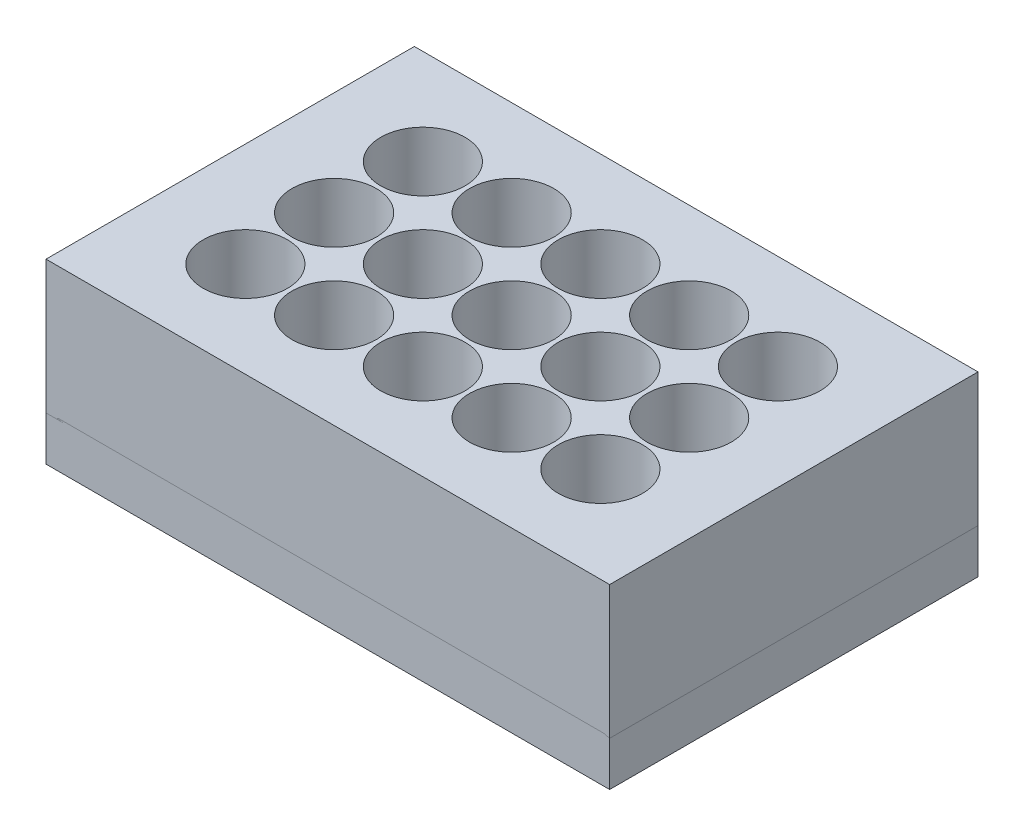
from build123d import *

# Parameters (mm, degrees)
SKETCH1_W            = 127
SKETCH1_H            = 83
BOSS_EXTRUDE1_DEPTH  = 10.31875
CUT_EXTRUDE2_DEPTH   = 2
CUT_EXTRUDE3_DEPTH   = 4
SKETCH2_9_R          = 2.5
CUT_EXTRUDE8_DEPTH   = 77.557015365
LPATTERN2_COUNT      = 4
LPATTERN2_PITCH      = 20
LPATTERN2_COUNT_DIR2 = 6
LPATTERN2_PITCH_DIR2 = 20
LPATTERN3_COUNT      = 3
LPATTERN3_PITCH      = 20
LPATTERN3_COUNT_DIR2 = 5
LPATTERN3_PITCH_DIR2 = 20
SKETCH4_W            = 127
SKETCH4_H            = 83
BOSS_EXTRUDE3_DEPTH  = 30
SKETCH10_R           = 9.5
CUT_EXTRUDE11_DEPTH  = 80.871772235
CUT_EXTRUDE9_START   = 3.7
SKETCH8_R            = 2.5
CUT_EXTRUDE9_DEPTH   = 3.7
SKETCH8_11_R         = 2.2352
CUT_EXTRUDE10_DEPTH  = 82.575118756
CUT_EXTRUDE12_START  = -82.575118756
SKETCH8_12_R         = 4.0132
SKETCH8_12_R_2       = 2.2352
CUT_EXTRUDE12_DEPTH  = 83.641918756
LPATTERN4_COUNT      = 6
LPATTERN4_PITCH      = 20
LPATTERN4_COUNT_DIR2 = 4
LPATTERN4_PITCH_DIR2 = 20
SKETCH8_13_R         = 6.4008
SKETCH8_13_R_2       = 4.6228
CUT_EXTRUDE16_DEPTH  = 1.3208
LPATTERN5_COUNT      = 5
LPATTERN5_PITCH      = 20
LPATTERN5_COUNT_DIR2 = 3
LPATTERN5_PITCH_DIR2 = 20


with BuildPart() as part:
    # Sketch1 → Boss-Extrude1 (new body)
    with BuildSketch(Plane(origin=(0, 0, 0), x_dir=(1, 0, 0), z_dir=(0, 1, 0))):
        Rectangle(SKETCH1_W, SKETCH1_H)
    extrude(amount=BOSS_EXTRUDE1_DEPTH)

    # Sketch2 → Cut-Extrude2 (cut)
    with BuildSketch(Plane(origin=(0, 10.31875, 0), x_dir=(1, 0, 0), z_dir=(0, 1, 0))):
        with BuildLine():
            ThreePointArc((-45.247281281, -24.625), (-45.689223019, -25.691941738), (-44.622281281, -25.25))
            Line((-44.622281281, -25.25), (-35.372281281, -25.25))
            ThreePointArc((-35.372281281, -25.25), (-34.305339543, -25.691941738), (-34.747281281, -24.625))
            Line((-34.747281281, -24.625), (-34.747281281, -15.375))
            ThreePointArc((-34.747281281, -15.375), (-34.305339543, -14.308058262), (-35.372281281, -14.75))
            Line((-35.372281281, -14.75), (-44.622281281, -14.75))
            ThreePointArc((-44.622281281, -14.75), (-45.689223019, -14.308058262), (-45.247281281, -15.375))
            Line((-45.247281281, -15.375), (-45.247281281, -24.625))
        make_face()
    cut_extrude2 = extrude(amount=-CUT_EXTRUDE2_DEPTH, mode=Mode.SUBTRACT)

    # Sketch2<6> → Cut-Extrude3 (cut)
    with BuildSketch(Plane(origin=(0, 10.31875, 0), x_dir=(1, 0, 0), z_dir=(0, 1, 0))):
        with BuildLine():
            ThreePointArc((-52.58, -30), (-51.847766953, -31.767766953), (-50.08, -32.5))
            ThreePointArc((-50.08, -32.5), (-48.312233047, -31.767766953), (-47.58, -30))
            ThreePointArc((-47.58, -30), (-50.08, -27.5), (-52.58, -30))
        make_face()
    cut_extrude3 = extrude(amount=-CUT_EXTRUDE3_DEPTH, mode=Mode.SUBTRACT)

    # Sketch2<9> → Cut-Extrude8 (cut, through all)
    with BuildSketch(Plane(origin=(0, 10.31875, 0), x_dir=(1, 0, 0), z_dir=(0, 1, 0))):
        with Locations((-40.08, -20)):
            Circle(SKETCH2_9_R)
    cut_extrude8 = extrude(amount=-CUT_EXTRUDE8_DEPTH, mode=Mode.SUBTRACT)

    # LPattern2: Cut-Extrude3 4 × 6
    with Locations(*[(j * LPATTERN2_PITCH_DIR2, 0, -i * LPATTERN2_PITCH) for i in range(LPATTERN2_COUNT) for j in range(LPATTERN2_COUNT_DIR2) if (i, j) != (0, 0)]):
        add(cut_extrude3, mode=Mode.SUBTRACT)

    # LPattern3: Cut-Extrude2, Cut-Extrude8 3 × 5
    with Locations(*[(j * LPATTERN3_PITCH_DIR2, 0, -i * LPATTERN3_PITCH) for i in range(LPATTERN3_COUNT) for j in range(LPATTERN3_COUNT_DIR2) if (i, j) != (0, 0)]):
        add(cut_extrude2, mode=Mode.SUBTRACT)
        add(cut_extrude8, mode=Mode.SUBTRACT)


with BuildPart() as body_2:
    # Sketch4 → Boss-Extrude3 (new body)
    with BuildSketch(Plane(origin=(0, 10, 0), x_dir=(1, 0, 0), z_dir=(0, 1, 0))):
        Rectangle(SKETCH4_W, SKETCH4_H)
    extrude(amount=BOSS_EXTRUDE3_DEPTH)

    # Sketch10 → Cut-Extrude11 (cut, through all)
    with BuildSketch(Plane(origin=(0, 15, 0), x_dir=(1, 0, 0), z_dir=(0, 1, 0))):
        with Locations((-40.08, -20)):
            Circle(SKETCH10_R)
    cut_extrude11 = extrude(amount=CUT_EXTRUDE11_DEPTH, mode=Mode.SUBTRACT)

    # Sketch8 → Cut-Extrude9 (cut)
    with BuildSketch(Plane(origin=(0, 10, 0), x_dir=(1, 0, 0), z_dir=(0, 1, 0)).offset(CUT_EXTRUDE9_START)):
        with Locations((-50.08, -30)):
            Circle(SKETCH8_R)
    cut_extrude9 = extrude(amount=-CUT_EXTRUDE9_DEPTH, mode=Mode.SUBTRACT)

    # Sketch8<11> → Cut-Extrude10 (cut, through all)
    with BuildSketch(Plane(origin=(0, 10, 0), x_dir=(1, 0, 0), z_dir=(0, 1, 0))):
        with Locations((-40.08, -20)):
            Circle(SKETCH8_11_R)
    cut_extrude10 = extrude(amount=CUT_EXTRUDE10_DEPTH, mode=Mode.SUBTRACT)

    # Sketch8<12> → Cut-Extrude12 (cut)
    with BuildSketch(Plane(origin=(0, 10, 0), x_dir=(1, 0, 0), z_dir=(0, 1, 0)).offset(CUT_EXTRUDE12_START)):
        with Locations((-40.08, -20)):
            Circle(SKETCH8_12_R)
        with Locations((-40.08, -20)):
            Circle(SKETCH8_12_R_2, mode=Mode.SUBTRACT)
    cut_extrude12 = extrude(amount=CUT_EXTRUDE12_DEPTH, mode=Mode.SUBTRACT)

    # LPattern4: Cut-Extrude9 6 × 4
    with Locations(*[(i * LPATTERN4_PITCH, 0, -j * LPATTERN4_PITCH_DIR2) for i in range(LPATTERN4_COUNT) for j in range(LPATTERN4_COUNT_DIR2) if (i, j) != (0, 0)]):
        add(cut_extrude9, mode=Mode.SUBTRACT)

    # Sketch8<13> → Cut-Extrude16 (cut)
    with BuildSketch(Plane(origin=(0, 10, 0), x_dir=(1, 0, 0), z_dir=(0, 1, 0))):
        with Locations((-40.08, -20)):
            Circle(SKETCH8_13_R)
        with Locations((-40.08, -20)):
            Circle(SKETCH8_13_R_2, mode=Mode.SUBTRACT)
    cut_extrude16 = extrude(amount=CUT_EXTRUDE16_DEPTH, mode=Mode.SUBTRACT)

    # LPattern5: Cut-Extrude11, Cut-Extrude10, Cut-Extrude12, Cut-Extrude16 5 × 3
    with Locations(*[(i * LPATTERN5_PITCH, 0, -j * LPATTERN5_PITCH_DIR2) for i in range(LPATTERN5_COUNT) for j in range(LPATTERN5_COUNT_DIR2) if (i, j) != (0, 0)]):
        add(cut_extrude11, mode=Mode.SUBTRACT)
        add(cut_extrude10, mode=Mode.SUBTRACT)
        add(cut_extrude12, mode=Mode.SUBTRACT)
        add(cut_extrude16, mode=Mode.SUBTRACT)


solid = Compound([part.part, body_2.part])
